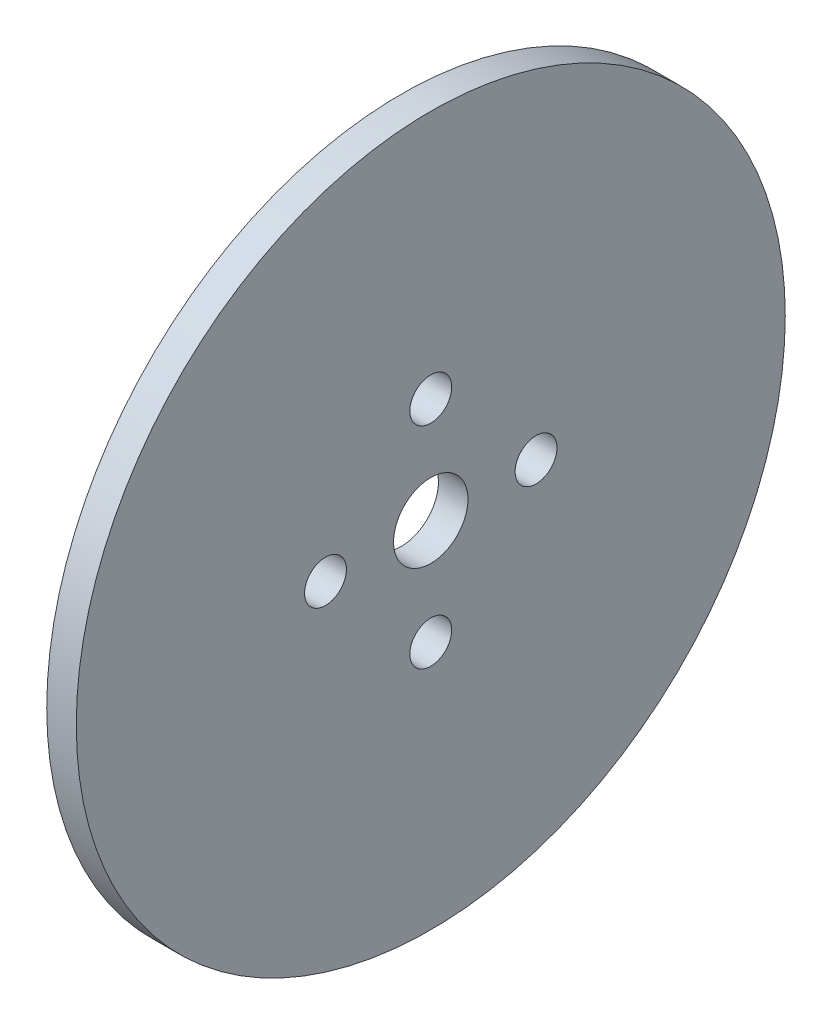
from build123d import *

# Parameters (mm, degrees)
SKETCH1_R           = 38.1
SKETCH1_R_2         = 4
BOSS_EXTRUDE2_DEPTH = 3.175
SKETCH4_R           = 2.25
CUT_EXTRUDE3_DEPTH  = 30.394


with BuildPart() as part:
    # Sketch1 → Boss-Extrude2 (new body)
    with BuildSketch(Plane.YZ):
        with Locations(Location((0, 0, 0), (0, 0, 270))):
            Circle(SKETCH1_R)
        with Locations(Location((0, 0, 0), (0, 0, 270))):
            Circle(SKETCH1_R_2, mode=Mode.SUBTRACT)
    extrude(amount=BOSS_EXTRUDE2_DEPTH)

    # Sketch4 → Cut-Extrude3 (cut)
    with BuildSketch(Plane.YZ.offset(3.175)):
        with Locations(Location((0, 11.313708499, 0), (0, 0, 270))):
            Circle(SKETCH4_R)
        with Locations(Location((11.313708499, 0, 0), (0, 0, 270))):
            Circle(SKETCH4_R)
        with Locations(Location((-11.313708499, 0, 0), (0, 0, 270))):
            Circle(SKETCH4_R)
        with Locations(Location((0, -11.313708499, 0), (0, 0, 270))):
            Circle(SKETCH4_R)
    extrude(amount=-CUT_EXTRUDE3_DEPTH, mode=Mode.SUBTRACT)


solid = part.part
